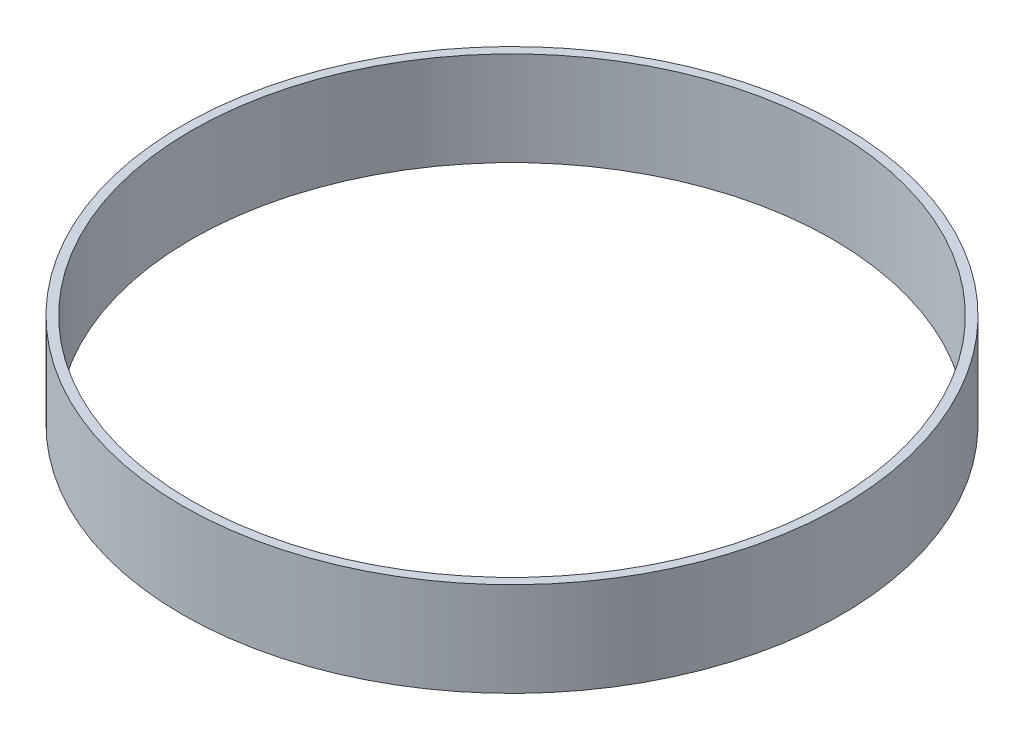
from build123d import *

# Parameters (mm, degrees)
SKETCH_1_R      = 35
SKETCH_1_R_2    = 34.05
EXTRUDE_1_DEPTH = 10


with BuildPart() as part:
    # 草图1 → 凸台-拉伸1 (new body)
    with BuildSketch(Plane(origin=(0, 0, 0), x_dir=(1, 0, 0), z_dir=(0, 1, 0))):
        with Locations(Location((0, 0, 0), (0, 0, 270))):
            Circle(SKETCH_1_R)
        with Locations(Location((0, 0, 0), (0, 0, 270))):
            Circle(SKETCH_1_R_2, mode=Mode.SUBTRACT)
    extrude(amount=EXTRUDE_1_DEPTH)


solid = part.part
